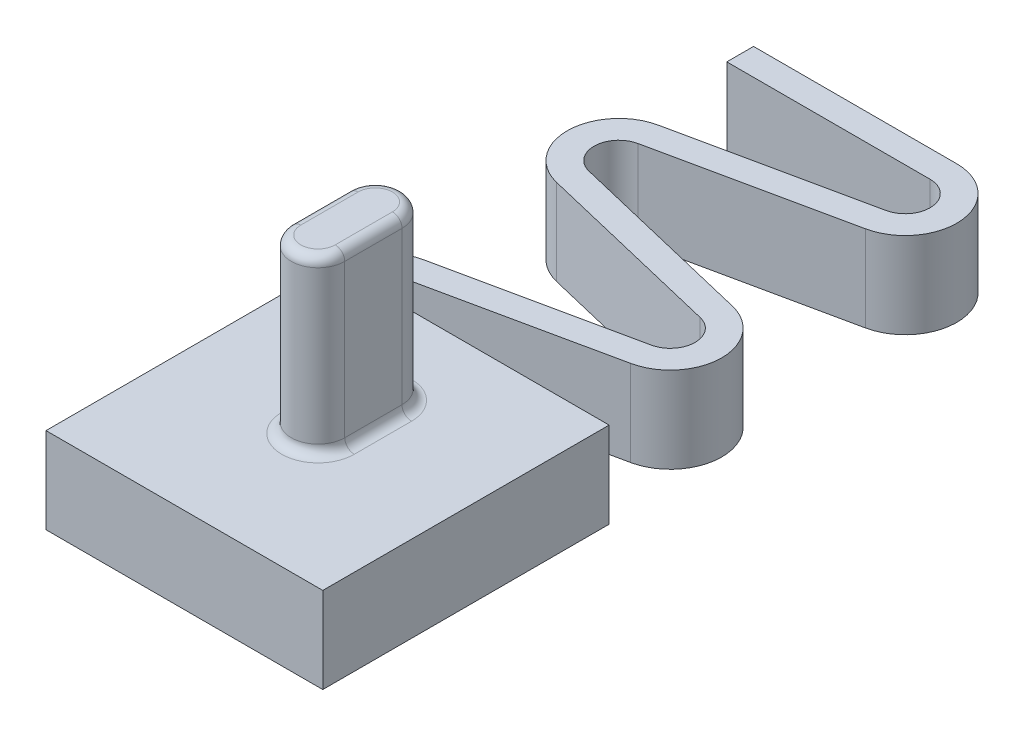
from build123d import *

# Parameters (mm, degrees)
SKETCH1_W           = 14.5
SKETCH1_H           = 15
BOSS_EXTRUDE1_DEPTH = 4.5
EXTRUDE_THIN1_DEPTH = 4.5
BOSS_EXTRUDE2_DEPTH = 9
FILLET2_R           = 0.5


with BuildPart() as part:
    # Sketch1 → Boss-Extrude1 (new body)
    with BuildSketch(Plane(origin=(0, 0, 0), x_dir=(1, 0, 0), z_dir=(0, 1, 0))):
        Rectangle(SKETCH1_W, SKETCH1_H)
    extrude(amount=BOSS_EXTRUDE1_DEPTH)

    # Sketch2 → Extrude-Thin1 (add)
    with BuildSketch(Plane(origin=(0, 4.5, 0), x_dir=(1, 0, 0), z_dir=(0, 1, 0))):
        with BuildLine():
            Line((-5.85, 5.540513031), (-5.85, 7.5))
            ThreePointArc((-5.85, 7.5), (-5.56028975, 8.318116508), (-4.820285198, 8.771591881))
            Line((-4.820285198, 8.771591881), (5.011361565, 10.861372913))
            ThreePointArc((5.011361565, 10.861372913), (7.149778281, 13.467770346), (5.078861565, 16.128115735))
            Line((5.078861565, 16.128115735), (-4.802785198, 18.494754348))
            ThreePointArc((-4.802785198, 18.494754348), (-5.799893246, 19.775661387), (-4.770285198, 21.030593485))
            Line((-4.770285198, 21.030593485), (5.061361565, 23.120374517))
            ThreePointArc((5.061361565, 23.120374517), (7.185209117, 26.043599889), (4.5, 28.461373039))
            Line((4.5, 28.461373039), (-6.14655289, 28.461373039))
            Line((-6.14655289, 28.461373039), (-6.14655289, 27.061373039))
            Line((-6.14655289, 27.061373039), (4.5, 27.061373039))
            ThreePointArc((4.5, 27.061373039), (5.792878464, 25.897260041), (4.770285198, 24.489781158))
            Line((4.770285198, 24.489781158), (-5.061361565, 22.400000126))
            ThreePointArc((-5.061361565, 22.400000126), (-7.199778281, 19.793602693), (-5.128861565, 17.133257304))
            Line((-5.128861565, 17.133257304), (4.752785198, 14.76661869))
            ThreePointArc((4.752785198, 14.76661869), (5.749893246, 13.485711651), (4.720285198, 12.230779554))
            Line((4.720285198, 12.230779554), (-5.111361565, 10.140998522))
            ThreePointArc((-5.111361565, 10.140998522), (-6.648294096, 9.199165056), (-7.25, 7.5))
            Line((-7.25, 7.5), (-7.25, 5.540513031))
            Line((-7.25, 5.540513031), (-5.85, 5.540513031))
        make_face()
    extrude(amount=-EXTRUDE_THIN1_DEPTH)

    # Sketch3 → Boss-Extrude2 (add)
    with BuildSketch(Plane(origin=(0, 4.5, 0), x_dir=(1, 0, 0), z_dir=(0, 1, 0))):
        with BuildLine():
            Line((1.4, 2.5), (1.4, -0.5))
            ThreePointArc((1.4, -0.5), (0, -1.9), (-1.4, -0.5))
            Line((-1.4, -0.5), (-1.4, 2.5))
            ThreePointArc((-1.4, 2.5), (0, 3.9), (1.4, 2.5))
        make_face()
    extrude(amount=BOSS_EXTRUDE2_DEPTH)

    # Fillet2
    fillet2_edges = [part.edges().sort_by_distance(p)[0] for p in [
        (0, 4.5, -3.9),
        (-1.4, 4.5, -1),
        (0, 4.5, 1.9),
        (1.4, 4.5, -1),
        (0, 13.5, -3.9),
        (-1.4, 13.5, -1),
        (0, 13.5, 1.9),
        (1.4, 13.5, -1),
    ]]
    fillet(fillet2_edges, radius=FILLET2_R)


solid = part.part
